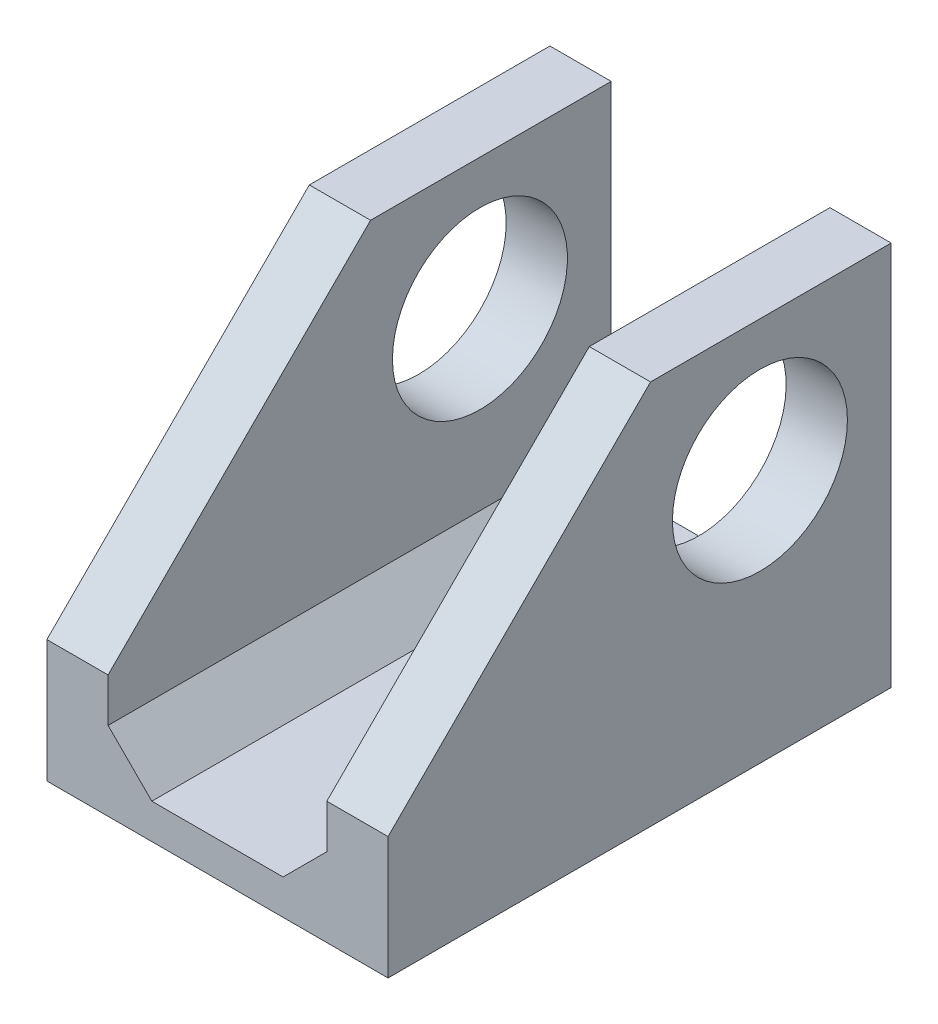
from build123d import *

# Parameters (mm, degrees)
BOSS_EXTRUDE1_DEPTH      = 85
BOSS_EXTRUDE1_DEPTH_BACK = 30
CUT_EXTRUDE1_DEPTH       = 134.120246394
CUT_EXTRUDE1_DEPTH_BACK  = 134.120246394
SKETCH3_R                = 20
CHAMFER1_SIZE            = 10
CHAMFER2_SIZE            = 60


with BuildPart() as part:
    # Sketch2 → Boss-Extrude1 (new, two sides: drawn at the far end of the back side and taken through both)
    with BuildSketch(Plane.XY.offset(-BOSS_EXTRUDE1_DEPTH_BACK)):
        Polygon((0, 0), (-50, 0), (-50, 80), (-64, 80), (-64, -8), (14, -8), (14, 80), (0, 80), align=None)
    extrude(amount=BOSS_EXTRUDE1_DEPTH + BOSS_EXTRUDE1_DEPTH_BACK)

    # Sketch3 → Cut-Extrude1 (cut, two sides: drawn at the far end of the back side and taken through both)
    with BuildSketch(Plane(origin=(0, 0, 0), x_dir=(0, 0, -1), z_dir=(1, 0, 0)).offset(-CUT_EXTRUDE1_DEPTH_BACK)):
        with Locations(Location((0, 50, 0), (0, 0, 90))):
            Circle(SKETCH3_R)
    extrude(amount=CUT_EXTRUDE1_DEPTH + CUT_EXTRUDE1_DEPTH_BACK, mode=Mode.SUBTRACT)

    # Chamfer1
    chamfer1_edges = [part.edges().sort_by_distance(p)[0] for p in [
        (-50, 0, 27.5),
        (0, 0, 27.5),
    ]]
    chamfer(chamfer1_edges, length=CHAMFER1_SIZE)

    # Chamfer2
    chamfer2_edges = [part.edges().sort_by_distance(p)[0] for p in [
        (-57, 80, 85),
        (7, 80, 85),
    ]]
    chamfer(chamfer2_edges, length=CHAMFER2_SIZE)


solid = part.part
